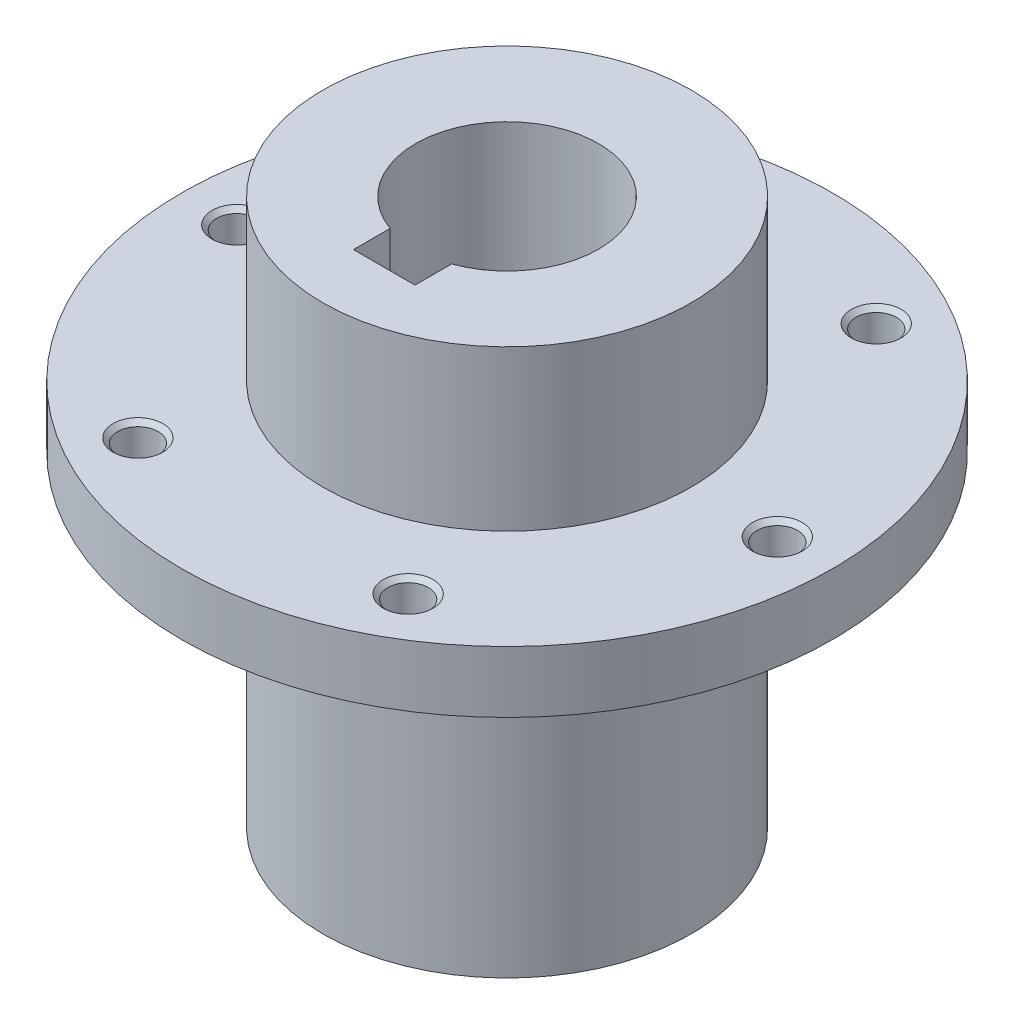
from build123d import *

# Parameters (mm, degrees)
SKETCH_1_R                   = 26.5
EXTRUDE_2_DEPTH              = 5
SKETCH_3_R                   = 15
EXTRUDE_3_DEPTH              = 13
EXTRUDE_START                = 26.5
SKETCH_4_R                   = 15
EXTRUDE_4_DEPTH              = 26.5
HOLE_WIZARD_M4_1_D           = 3.3
HOLE_WIZARD_M4_1_CSINK_D     = 4.05
HOLE_WIZARD_M4_1_CSINK_ANGLE = 90
PATTERN_CIRCULAR_1_COUNT     = 6
SKETCH_7_R                   = 7.45
CUT_EXTRUDE_1_DEPTH          = 44.5
SKETCH_8_W                   = 5.01
SKETCH_8_H                   = 5
CUT_EXTRUDE_2_DEPTH          = 44.5


with BuildPart() as part:
    # 草图1 → 凸台-拉伸2 (new body)
    with BuildSketch(Plane(origin=(0, 0, 0), x_dir=(1, 0, 0), z_dir=(0, 1, 0))):
        with Locations(Location((0, 0, 0), (0, 0, 270))):
            Circle(SKETCH_1_R)
    extrude(amount=EXTRUDE_2_DEPTH)

    # 草图3 → 凸台-拉伸3 (add)
    with BuildSketch(Plane(origin=(0, 5, 0), x_dir=(1, 0, 0), z_dir=(0, 1, 0))):
        with Locations(Location((0, 0, 0), (0, 0, 90))):
            Circle(SKETCH_3_R)
    extrude(amount=EXTRUDE_3_DEPTH)

    # 草图4 → 凸台-拉伸4 (add)
    with BuildSketch(Plane.XZ.offset(EXTRUDE_START)):
        with Locations(Location((0, 0, 0), (0, 0, 270))):
            Circle(SKETCH_4_R)
    extrude(amount=-EXTRUDE_4_DEPTH)

    # M4 螺纹孔1 (through all)
    with Locations(Plane(origin=(22, 5, 0), x_dir=(0, 0, 1), z_dir=(0, 1, 0))):
        with Locations((0, 0)):
            hole_wizard_m4_1 = CounterSinkHole(HOLE_WIZARD_M4_1_D / 2, HOLE_WIZARD_M4_1_CSINK_D / 2, counter_sink_angle=HOLE_WIZARD_M4_1_CSINK_ANGLE)

    # 阵列(圆周)1: M4 螺纹孔1 ×6 about axis
    pattern_circular_1_axis = Axis((0, 0, 0), (0, 1, 0))
    for i in range(1, PATTERN_CIRCULAR_1_COUNT):
        add(hole_wizard_m4_1.rotate(pattern_circular_1_axis, i * 360 / PATTERN_CIRCULAR_1_COUNT), mode=Mode.SUBTRACT)

    # 草图7 → 切除-拉伸1 (cut)
    with BuildSketch(Plane(origin=(0, 18, 0), x_dir=(1, 0, 0), z_dir=(0, 1, 0))):
        with Locations(Location((0, 0, 0), (0, 0, 270))):
            Circle(SKETCH_7_R)
    extrude(amount=-CUT_EXTRUDE_1_DEPTH, mode=Mode.SUBTRACT)

    # 草图8 → 切除-拉伸2 (cut)
    with BuildSketch(Plane(origin=(0, 18, 0), x_dir=(1, 0, 0), z_dir=(0, 1, 0))):
        with Locations((0, -7.5)):
            Rectangle(SKETCH_8_W, SKETCH_8_H)
    extrude(amount=-CUT_EXTRUDE_2_DEPTH, mode=Mode.SUBTRACT)


solid = part.part
